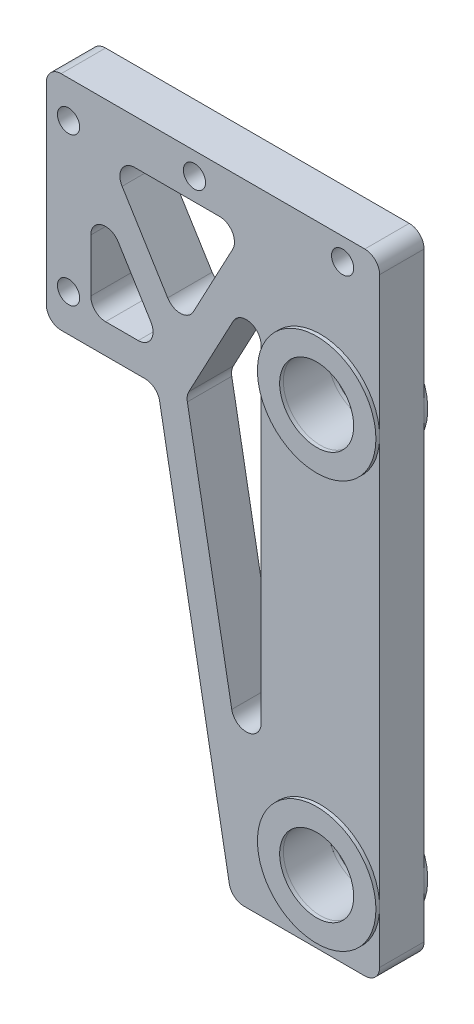
from build123d import *

# Parameters (mm, degrees)
SKETCH_1_R          = 6
SKETCH_1_R_2        = 1.5
EXTRUDE_1_DEPTH     = 6
SKETCH_2_R          = 6
SKETCH_2_R_2        = 5
EXTRUDE_2_DEPTH     = 6
EXTRUDE_2_2_DEPTH   = 6
CUT_EXTRUDE_1_DEPTH = 6
FILLET_2_R          = 2
SKETCH_4_R          = 8
SKETCH_4_R_2        = 5
EXTRUDE_3_DEPTH     = 0.5
EXTRUDE_3_2_DEPTH   = 0.5
SKETCH_5_R          = 8
SKETCH_5_R_2        = 5
EXTRUDE_4_DEPTH     = 0.5
EXTRUDE_4_2_DEPTH   = 0.5


with BuildPart() as part:
    # 草图1 → 凸台-拉伸1 (new body)
    with BuildSketch(Plane.XY):
        Polygon((-37, 20.95), (8, 20.95), (8, -64.05), (-12, -64.05), (-22, -9.05), (-37, -9.05), align=None)
        Circle(SKETCH_1_R, mode=Mode.SUBTRACT)
        with Locations((0, -55)):
            Circle(SKETCH_1_R, mode=Mode.SUBTRACT)
        with Locations((3, 17.95)):
            Circle(SKETCH_1_R_2, mode=Mode.SUBTRACT)
        with Locations((-17, 17.95)):
            Circle(SKETCH_1_R_2, mode=Mode.SUBTRACT)
        with Locations((-34, 15.95)):
            Circle(SKETCH_1_R_2, mode=Mode.SUBTRACT)
        with Locations((-34, -4.05)):
            Circle(SKETCH_1_R_2, mode=Mode.SUBTRACT)
    extrude(amount=EXTRUDE_1_DEPTH)

    # 草图3 → 切除-拉伸1 (cut)
    with BuildSketch(Plane.XY.offset(6)):
        Polygon((-8, -63.689320225), (-8, 10.698456851), (-18.085282501, -8.220266471), align=None)
        Polygon((-18.788186972, -1.035740679), (-10.266432729, 14.95), (-28.65003451, 14.95), align=None)
        Polygon((-31, -5.05), (-21.011660076, -5.05), (-31, 11.140780806), align=None)
    extrude(amount=-CUT_EXTRUDE_1_DEPTH, mode=Mode.SUBTRACT)

    # 圆角2
    fillet_2_edges = [part.edges().sort_by_distance(p)[0] for p in [
        (8, -64.05, 3),
        (-12, -64.05, 3),
        (-22, -9.05, 3),
        (-37, -9.05, 3),
        (-37, 20.95, 3),
        (8, 20.95, 3),
        (-10.266432729, 14.95, 3),
        (-28.65003451, 14.95, 3),
        (-18.788186972, -1.035740679, 3),
        (-31, 11.140780806, 3),
        (-21.011660076, -5.05, 3),
        (-31, -5.05, 3),
        (-18.085282501, -8.220266471, 3),
        (-8, -63.689320225, 3),
        (-8, 10.698456851, 3),
    ]]
    fillet(fillet_2_edges, radius=FILLET_2_R)


with BuildPart() as body_2:
    # 草图2 → 凸台-拉伸2 (new body)
    with BuildSketch(Plane.XY.offset(6)):
        with Locations((0, -55)):
            Circle(SKETCH_2_R)
        with Locations((0, -55)):
            Circle(SKETCH_2_R_2, mode=Mode.SUBTRACT)
    extrude(amount=-EXTRUDE_2_DEPTH)


with BuildPart() as body_3:
    # 草图2 → Extrude 2 2 (new body)
    with BuildSketch(Plane.XY.offset(6)):
        Circle(SKETCH_2_R)
        Circle(SKETCH_2_R_2, mode=Mode.SUBTRACT)
    extrude(amount=-EXTRUDE_2_2_DEPTH)


with BuildPart() as body_4:
    # 草图4 → 凸台-拉伸3 (new body)
    with BuildSketch(Plane.XY.offset(6)):
        Circle(SKETCH_4_R)
        Circle(SKETCH_4_R_2, mode=Mode.SUBTRACT)
    extrude(amount=EXTRUDE_3_DEPTH)


with BuildPart() as body_5:
    # 草图4 → Extrude 3 2 (new body)
    with BuildSketch(Plane.XY.offset(6)):
        with Locations((0, -55)):
            Circle(SKETCH_4_R)
        with Locations((0, -55)):
            Circle(SKETCH_4_R_2, mode=Mode.SUBTRACT)
    extrude(amount=EXTRUDE_3_2_DEPTH)


with BuildPart() as body_6:
    # 草图5 → 凸台-拉伸4 (new body)
    with BuildSketch(Plane(origin=(0, 0, 0), x_dir=(-1, 0, 0), z_dir=(0, 0, -1))):
        with Locations((0, -55)):
            Circle(SKETCH_5_R)
        with Locations((0, -55)):
            Circle(SKETCH_5_R_2, mode=Mode.SUBTRACT)
    extrude(amount=EXTRUDE_4_DEPTH)


with BuildPart() as body_7:
    # 草图5 → Extrude 4 2 (new body)
    with BuildSketch(Plane(origin=(0, 0, 0), x_dir=(-1, 0, 0), z_dir=(0, 0, -1))):
        Circle(SKETCH_5_R)
        Circle(SKETCH_5_R_2, mode=Mode.SUBTRACT)
    extrude(amount=EXTRUDE_4_2_DEPTH)


solid = Compound([part.part, body_2.part, body_3.part, body_4.part, body_5.part, body_6.part, body_7.part])
